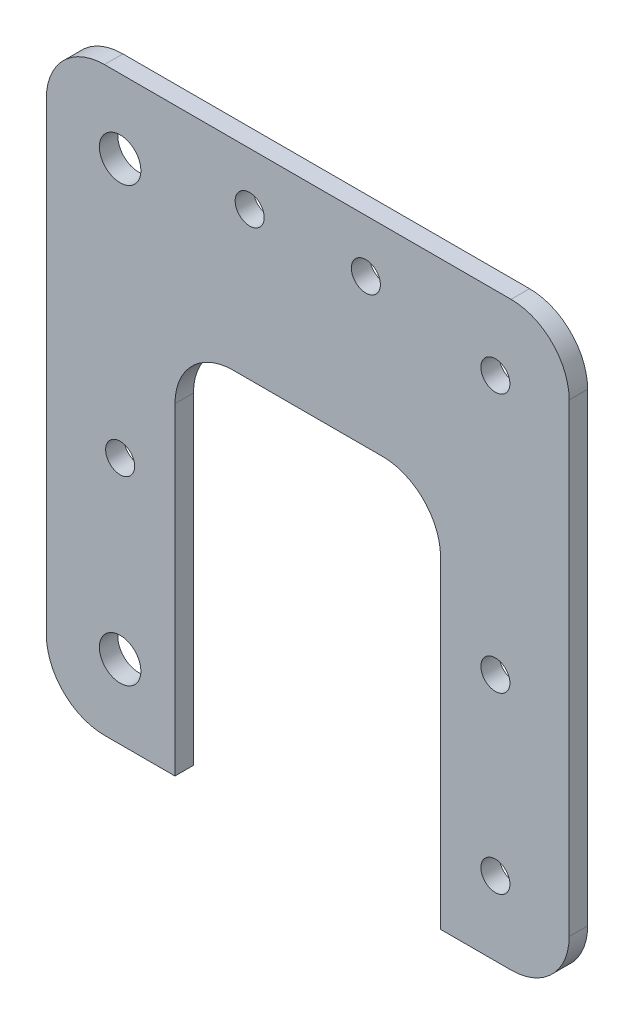
from build123d import *

# Parameters (mm, degrees)
BOSS_EXTRUDE1_START = 19.16
SKETCH1_W           = 90
SKETCH1_H           = 100
SKETCH1_R           = 2.5
SKETCH1_R_2         = 3.57
BOSS_EXTRUDE1_DEPTH = 3.18
SKETCH2_W           = 45.72
SKETCH2_H           = 65.511870912
CUT_EXTRUDE1_DEPTH  = 72.134467033
FILLET1_R           = 10
SKETCH3_R           = 2.5
CUT_EXTRUDE2_DEPTH  = 72.134467033


with BuildPart() as part:
    # Sketch1 → Boss-Extrude1 (new body)
    with BuildSketch(Plane.XY.offset(BOSS_EXTRUDE1_START)):
        with Locations((0, -5)):
            Rectangle(SKETCH1_W, SKETCH1_H)
        with Locations((32.3, -12.3)):
            Circle(SKETCH1_R, mode=Mode.SUBTRACT)
        with Locations((32.3, -42.3)):
            Circle(SKETCH1_R, mode=Mode.SUBTRACT)
        with Locations((-32.3, -42.3)):
            Circle(SKETCH1_R_2, mode=Mode.SUBTRACT)
        with Locations((-32.3, -12.3)):
            Circle(SKETCH1_R, mode=Mode.SUBTRACT)
        with Locations((-32.3, 32.3)):
            Circle(SKETCH1_R_2, mode=Mode.SUBTRACT)
        with Locations((32.3, 32.3)):
            Circle(SKETCH1_R, mode=Mode.SUBTRACT)
    extrude(amount=-BOSS_EXTRUDE1_DEPTH)

    # Sketch2 → Cut-Extrude1 (cut, through all)
    with BuildSketch(Plane(origin=(0, 0, 15.98), x_dir=(-1, 0, 0), z_dir=(0, 0, -1))):
        with Locations((0, -22.244064544)):
            Rectangle(SKETCH2_W, SKETCH2_H)
    extrude(amount=-CUT_EXTRUDE1_DEPTH, mode=Mode.SUBTRACT)

    # Fillet1
    fillet1_edges = [part.edges().sort_by_distance(p)[0] for p in [
        (22.86, 10.511870912, 17.57),
        (-22.86, 10.511870912, 17.57),
        (-45, 45, 17.57),
        (45, 45, 17.57),
        (45, -55, 17.57),
        (-45, -55, 17.57),
    ]]
    fillet(fillet1_edges, radius=FILLET1_R)

    # Sketch3 → Cut-Extrude2 (cut, through all)
    with BuildSketch(Plane.XY.offset(19.16)):
        with Locations((10, 35.930865744)):
            Circle(SKETCH3_R)
        with Locations((-10, 35.930865744)):
            Circle(SKETCH3_R)
    extrude(amount=-CUT_EXTRUDE2_DEPTH, mode=Mode.SUBTRACT)


solid = part.part
